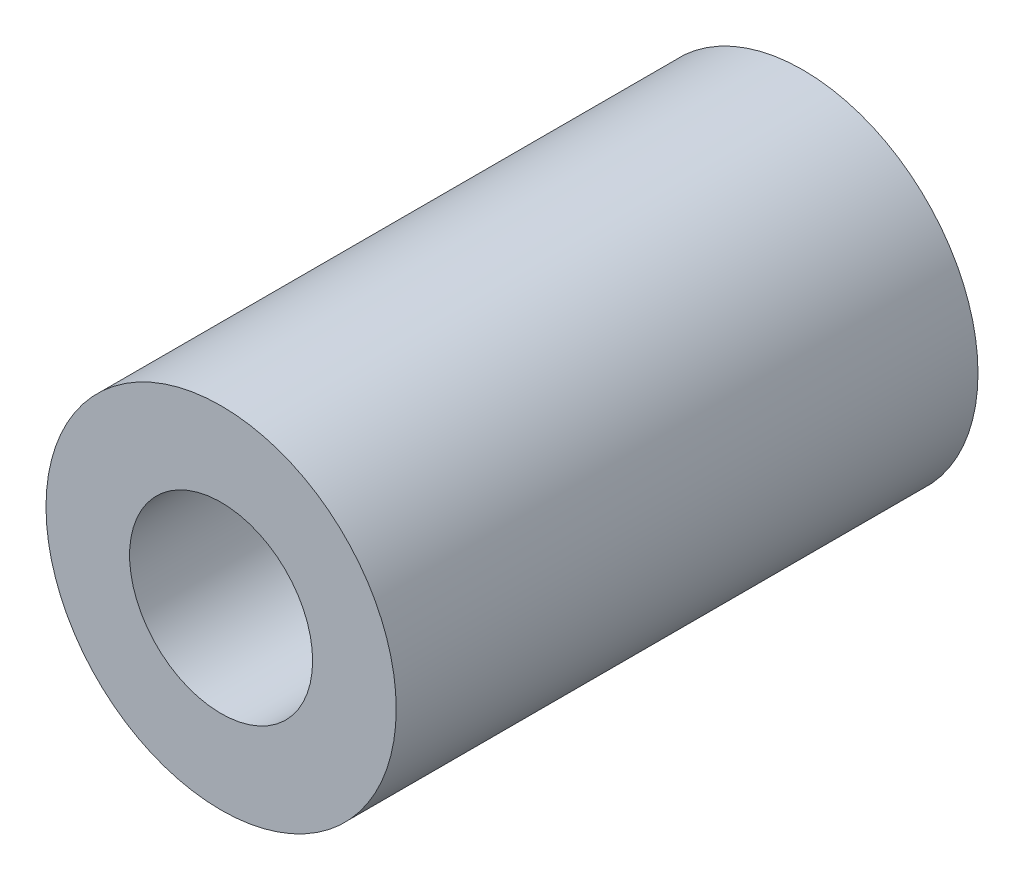
from build123d import *

# Parameters (mm, degrees)
SKETCH1_R           = 4.7625
SKETCH1_R_2         = 2.4892
BOSS_EXTRUDE1_DEPTH = 7.9121


with BuildPart() as part:
    # Sketch1 → Boss-Extrude1 (new, symmetric)
    with BuildSketch(Plane.XY):
        Circle(SKETCH1_R)
        Circle(SKETCH1_R_2, mode=Mode.SUBTRACT)
    extrude(amount=BOSS_EXTRUDE1_DEPTH, both=True)


solid = part.part
